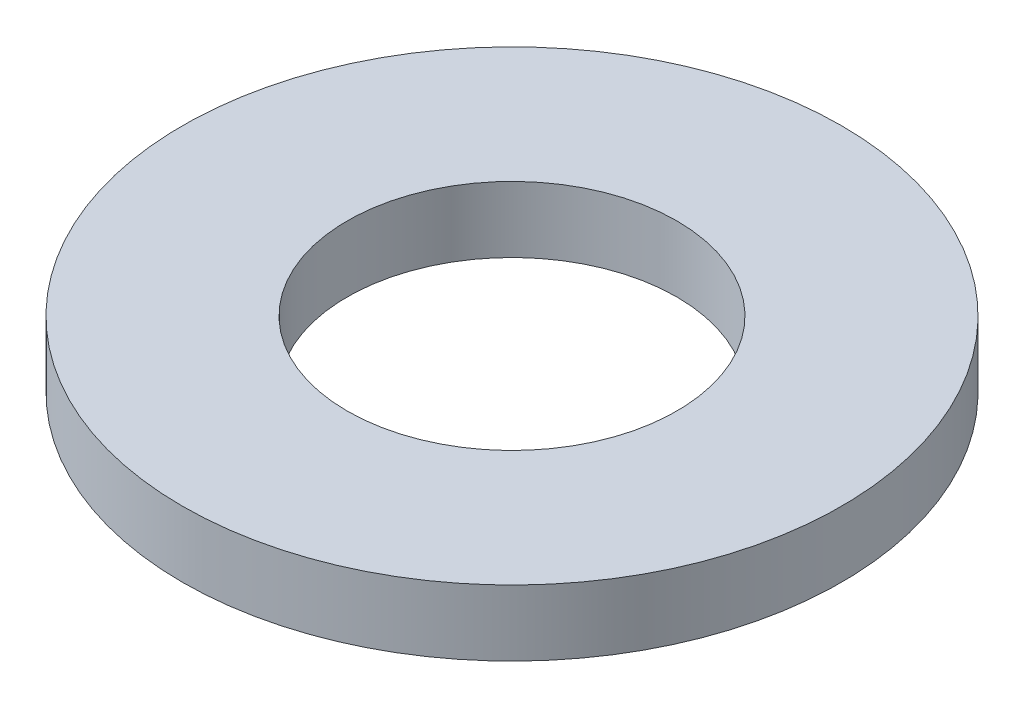
from build123d import *

# Parameters (mm, degrees)
BODYSKE_W = 2
BODYSKE_H = 0.8


with BuildPart() as part:
    # BodySke → BaseBody (revolve)
    with BuildSketch(Plane(origin=(0, 0, 0), x_dir=(1, 0, 0), z_dir=(0, 0, -1)), mode=Mode.PRIVATE) as basebody_sk:
        with Locations((3, 0.4)):
            Rectangle(BODYSKE_W, BODYSKE_H)
    revolve(basebody_sk.sketch.rotate(Axis((0, 0, 0), (0, -1, 0)), 90), axis=Axis((0, 0, 0), (0, -1, 0)))


solid = part.part
